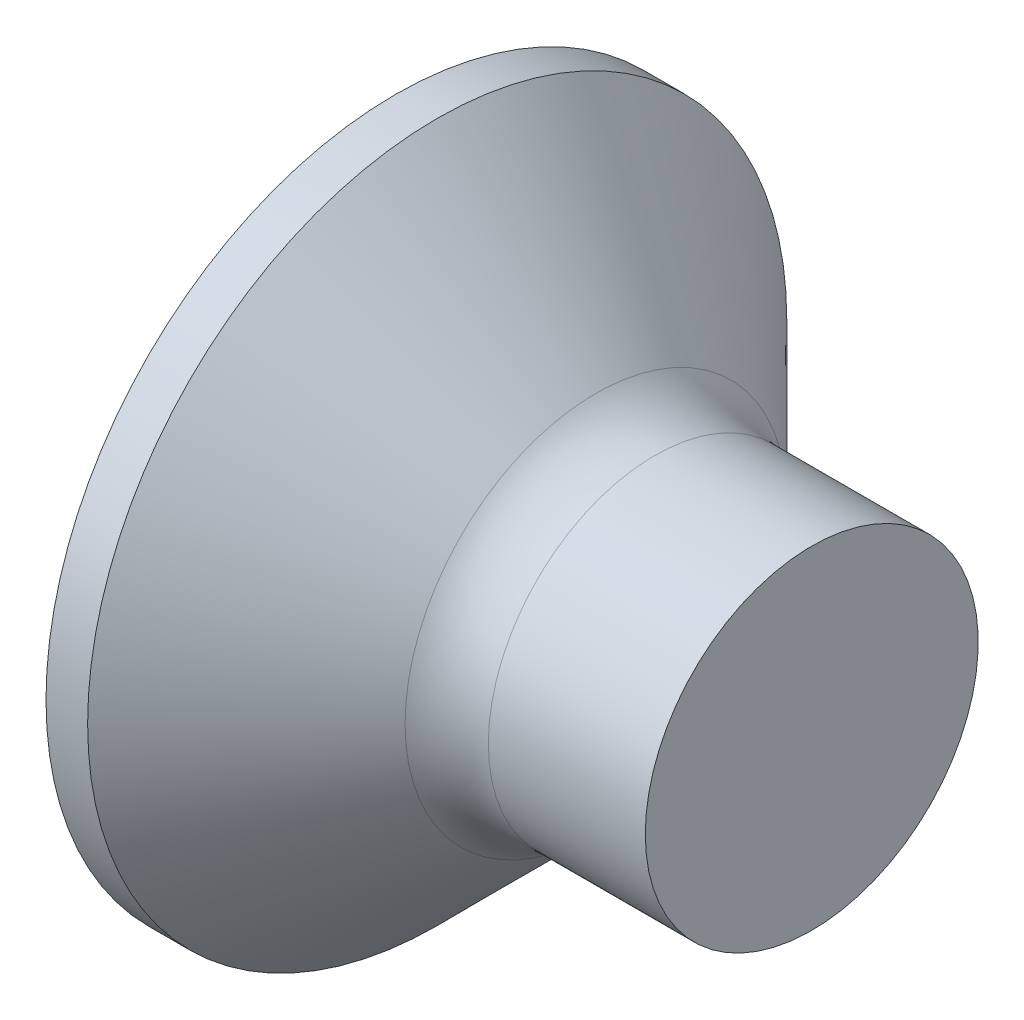
from build123d import *

# Parameters (mm, degrees)
FILLET1_R    = 1
RECPAT_COUNT = 2
RECPAT_ANGLE = 90


with BuildPart() as part:
    # BodySke → Base-Revolve (revolve)
    with BuildSketch(Plane.XY, mode=Mode.PRIVATE) as base_revolve_sk:
        with BuildLine():
            Line((0, 0), (6, 0))
            Line((6, 0), (6, 2))
            Line((6, 2), (3.7, 2))
            Line((3.7, 2), (1.5, 4.2))
            Line((1.5, 4.2), (1, 4.2))
            ThreePointArc((1, 4.2), (0.253446079, 2.158703314), (0, 0))
        make_face()
    revolve(base_revolve_sk.sketch.rotate(Axis((-15.875, 0, 0), (1, 0, 0)), 90), axis=Axis((-15.875, 0, 0), (1, 0, 0)))

    # Fillet1
    fillet1_edges = [part.edges().sort_by_distance(p)[0] for p in [
        (3.7, 0, -2),
    ]]
    fillet(fillet1_edges, radius=FILLET1_R)

    # Sketch3 → Recess section 0
    with BuildSketch(Plane(origin=(0, 0, 0), x_dir=(0, 0, -1), z_dir=(1, 0, 0))):
        with BuildLine():
            Line((0.515, -2.5), (-0.515, -2.5))
            Line((-0.515, -2.5), (-0.515, 2.5))
            Line((-0.515, 2.5), (0.515, 2.5))
            Line((0.515, 2.5), (0.515, -2.5))
        make_face()
    # Sketch4 → Recess section 1
    with BuildSketch(Plane(origin=(3.1, 0, 0), x_dir=(0, 0, -1), z_dir=(1, 0, 0))):
        with BuildLine():
            Line((0.515, -0.954397274), (-0.515, -0.954397274))
            Line((-0.515, -0.954397274), (-0.515, 0.954397274))
            Line((-0.515, 0.954397274), (0.515, 0.954397274))
            Line((0.515, 0.954397274), (0.515, -0.954397274))
        make_face()
    recess = loft(mode=Mode.SUBTRACT)

    # RecPat: Recess ×2 about axis
    recpat_axis = Axis((0, 0, 0), (1, 0, 0))
    for i in range(1, RECPAT_COUNT):
        add(recess.rotate(recpat_axis, i * RECPAT_ANGLE / (RECPAT_COUNT - 1)), mode=Mode.SUBTRACT)

    # RecCorSke → RecessCore (revolve, cut)
    with BuildSketch(Plane.XY, mode=Mode.PRIVATE) as recesscore_sk:
        Polygon((0, 0), (0, 1.067773117), (3.1, 0.851), (3.376506661, 0), align=None)
    revolve(recesscore_sk.sketch.rotate(Axis((-3.175, 0, 0), (1, 0, 0)), 90), axis=Axis((-3.175, 0, 0), (1, 0, 0)), mode=Mode.SUBTRACT)


solid = part.part
